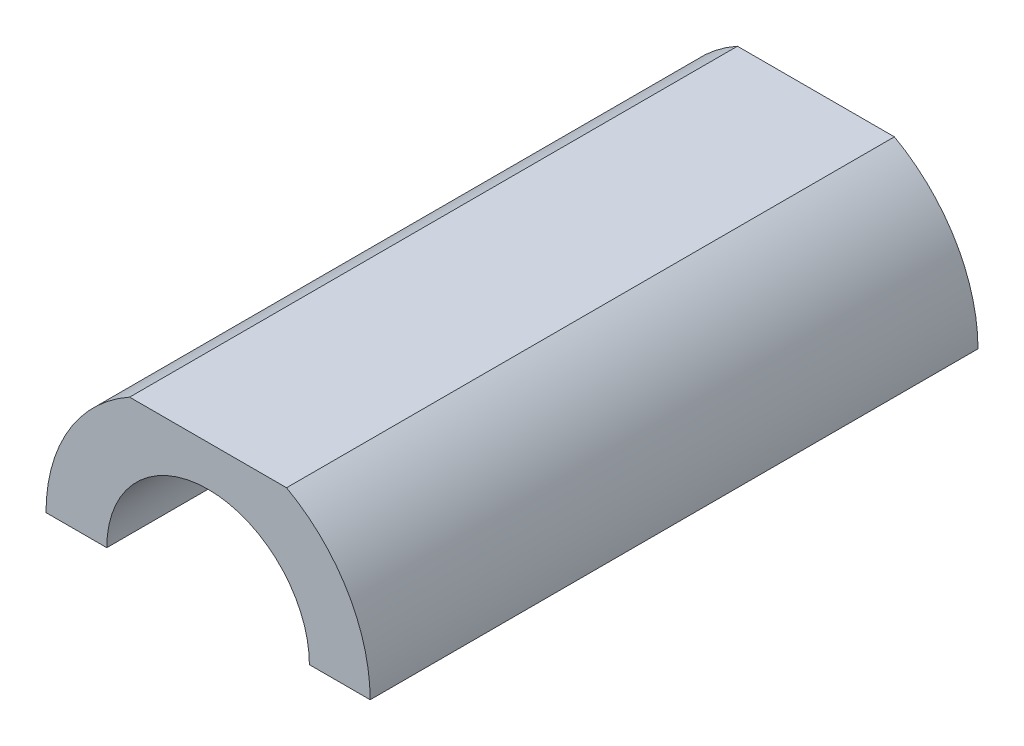
from build123d import *

# Parameters (mm, degrees)
SALIENTE_EXTRUIR1_DEPTH = 30


with BuildPart() as part:
    # Croquis1 → Saliente-Extruir1 (new body)
    with BuildSketch(Plane.XY):
        with BuildLine():
            Line((-8, 0), (-5, 0))
            ThreePointArc((-5, 0), (0, 5), (5, 0))
            Line((5, 0), (8, 0))
            ThreePointArc((8, 0), (6.891439137, 4.063012013), (3.872983346, 7))
            Line((3.872983346, 7), (-3.872983346, 7))
            ThreePointArc((-3.872983346, 7), (-6.891439137, 4.063012013), (-8, 0))
        make_face()
    extrude(amount=SALIENTE_EXTRUIR1_DEPTH)


solid = part.part
